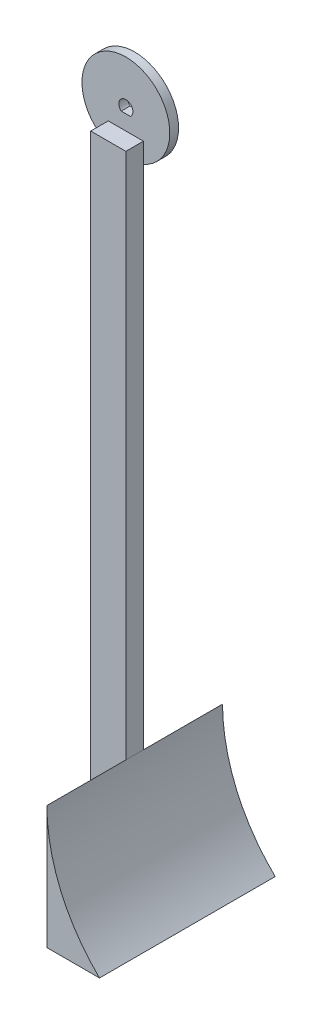
from build123d import *

# Parameters (mm, degrees)
SKETCH2_R           = 12.5
BOSS_EXTRUDE1_DEPTH = 2.5
BOSS_EXTRUDE2_DEPTH = 5
BOSS_EXTRUDE3_DEPTH = 15
SKETCH9_W           = 5
SKETCH9_H           = 25
BOSS_EXTRUDE4_DEPTH = 10
CUT_EXTRUDE1_DEPTH  = 142


with BuildPart() as part:
    # Sketch2 → Boss-Extrude1 (new body)
    with BuildSketch(Plane.XY):
        Circle(SKETCH2_R)
        with BuildLine():
            ThreePointArc((1.322875656, -1.5), (0, 2), (-1.322875656, -1.5))
            Line((-1.322875656, -1.5), (0, -1.5))
            Line((0, -1.5), (1.322875656, -1.5))
        make_face(mode=Mode.SUBTRACT)
    extrude(amount=BOSS_EXTRUDE1_DEPTH)

    # Sketch4 → Boss-Extrude2 (add)
    with BuildSketch(Plane.XY.offset(2.5)):
        Polygon((-5, -165.75443039), (5, -165.75443039), (5, -5.75443039), (0, -5.75443039), (-5, -5.75443039), align=None)
    extrude(amount=BOSS_EXTRUDE2_DEPTH)

    # Sketch5 → Boss-Extrude3 (add)
    with BuildSketch(Plane(origin=(5, 0, 0), x_dir=(0, 0, -1), z_dir=(1, 0, 0))):
        Polygon((20, -155.75443039), (-5, -155.75443039), (-30, -155.75443039), (-30, -190.75443039), (-5, -190.75443039), (20, -190.75443039), align=None)
    extrude(amount=BOSS_EXTRUDE3_DEPTH)

    # Sketch9 → Boss-Extrude4 (add)
    with BuildSketch(Plane.ZY.offset(5)):
        with Locations((5, -178.25443039)):
            Rectangle(SKETCH9_W, SKETCH9_H)
    extrude(amount=-BOSS_EXTRUDE4_DEPTH)

    # Sketch6 → Cut-Extrude1 (cut)
    with BuildSketch(Plane(origin=(0, 0, -20), x_dir=(-1, 0, 0), z_dir=(0, 0, -1))):
        with BuildLine():
            Line((-5, -155.75443039), (-20, -155.75443039))
            Line((-20, -155.75443039), (-20, -190.75443039))
            ThreePointArc((-20, -190.75443039), (-8.963631912, -174.770016714), (-5, -155.75443039))
        make_face()
    extrude(amount=-CUT_EXTRUDE1_DEPTH, mode=Mode.SUBTRACT)


solid = part.part
